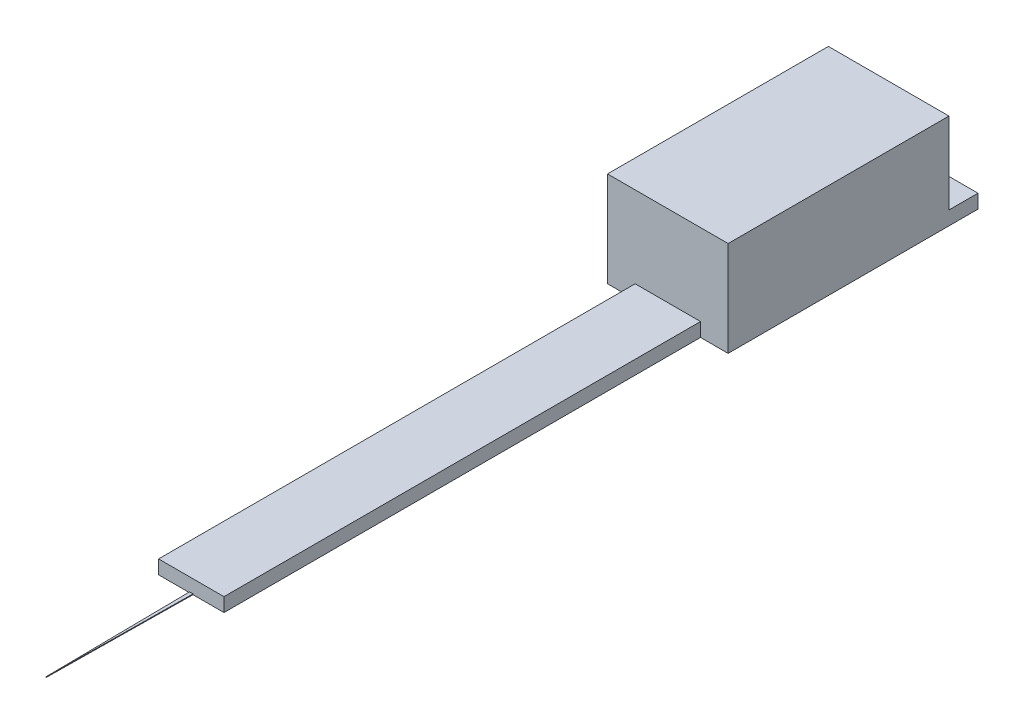
from build123d import *

# Parameters (mm, degrees)
EXTRUDE1_DEPTH = 0.05
EXTRUDE2_DEPTH = 0.9
SKETCH5_W      = 8.3
SKETCH5_H      = 15.2
EXTRUDE3_DEPTH = 5.6


with BuildPart() as part:
    # Sketch1 → Extrude1 (new body)
    with BuildSketch(Plane(origin=(0, 0, 0), x_dir=(1, 0, 0), z_dir=(0, 1, 0))):
        Polygon((0, 0), (0.12, 10), (2.25, 10), (2.25, 42.8), (4.15, 42.8), (4.15, 60), (-4.15, 60), (-4.15, 42.8), (-2.25, 42.8), (-2.25, 10), (-0.12, 10), align=None)
    extrude(amount=EXTRUDE1_DEPTH)

    # Sketch4 → Extrude2 (add)
    with BuildSketch(Plane(origin=(0, 0.05, 0), x_dir=(1, 0, 0), z_dir=(0, 1, 0))):
        Polygon((-4.15, 60), (4.15, 60), (4.15, 42.8), (2.25, 42.8), (2.25, 10), (-2.25, 10), (-2.25, 42.8), (-4.15, 42.8), align=None)
    extrude(amount=EXTRUDE2_DEPTH)

    # Sketch5 → Extrude3 (add)
    with BuildSketch(Plane(origin=(0, 0.95, 0), x_dir=(1, 0, 0), z_dir=(0, 1, 0))):
        with Locations((0, 50.4)):
            Rectangle(SKETCH5_W, SKETCH5_H)
    extrude(amount=EXTRUDE3_DEPTH)


solid = part.part
